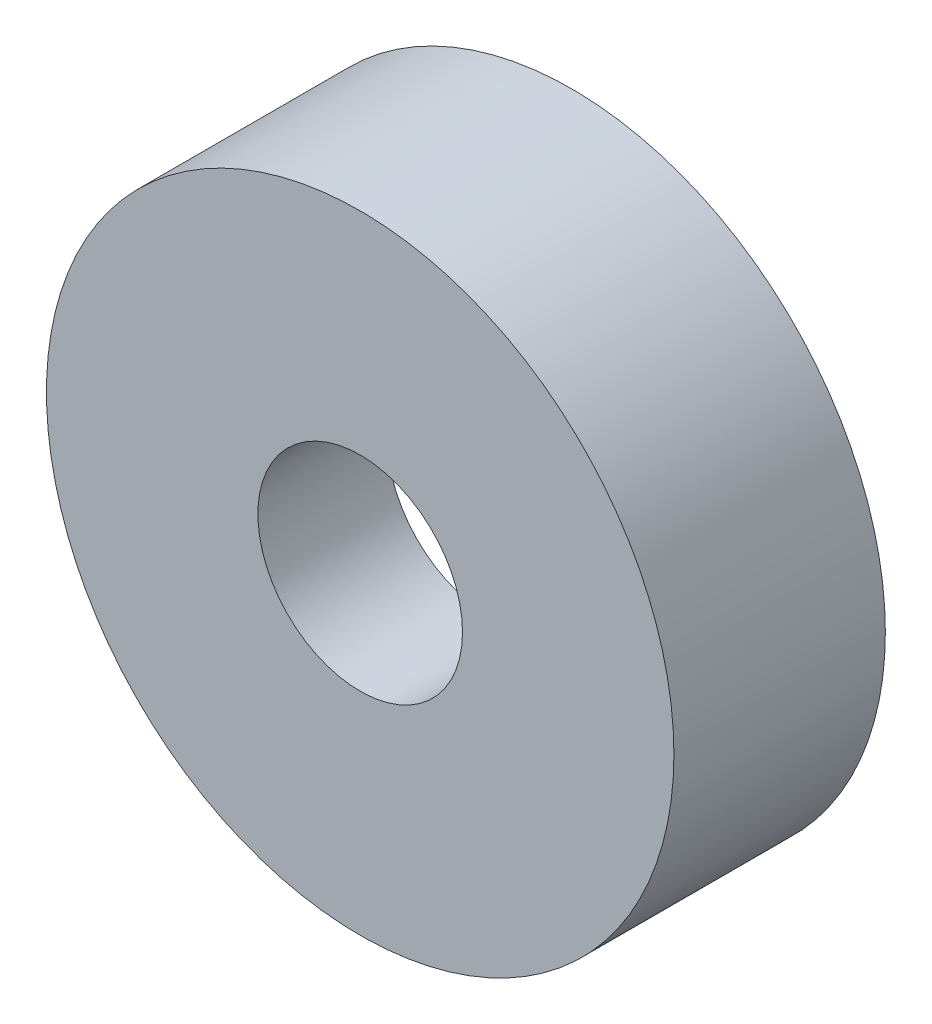
from build123d import *

# Parameters (mm, degrees)
SKETCH_1_R      = 23
SKETCH_1_R_2    = 21
EXTRUDE_1_DEPTH = 6
SKETCH_2_R      = 23
SKETCH_2_R_2    = 7.5
EXTRUDE_2_DEPTH = 9.5


with BuildPart() as part:
    # 草图1 → 凸台-拉伸1 (new body)
    with BuildSketch(Plane.XY):
        Circle(SKETCH_1_R)
        Circle(SKETCH_1_R_2, mode=Mode.SUBTRACT)
    extrude(amount=EXTRUDE_1_DEPTH)

    # 草图2 → 凸台-拉伸2 (add)
    with BuildSketch(Plane.XY.offset(6)):
        Circle(SKETCH_2_R)
        Circle(SKETCH_2_R_2, mode=Mode.SUBTRACT)
    extrude(amount=EXTRUDE_2_DEPTH)


solid = part.part
